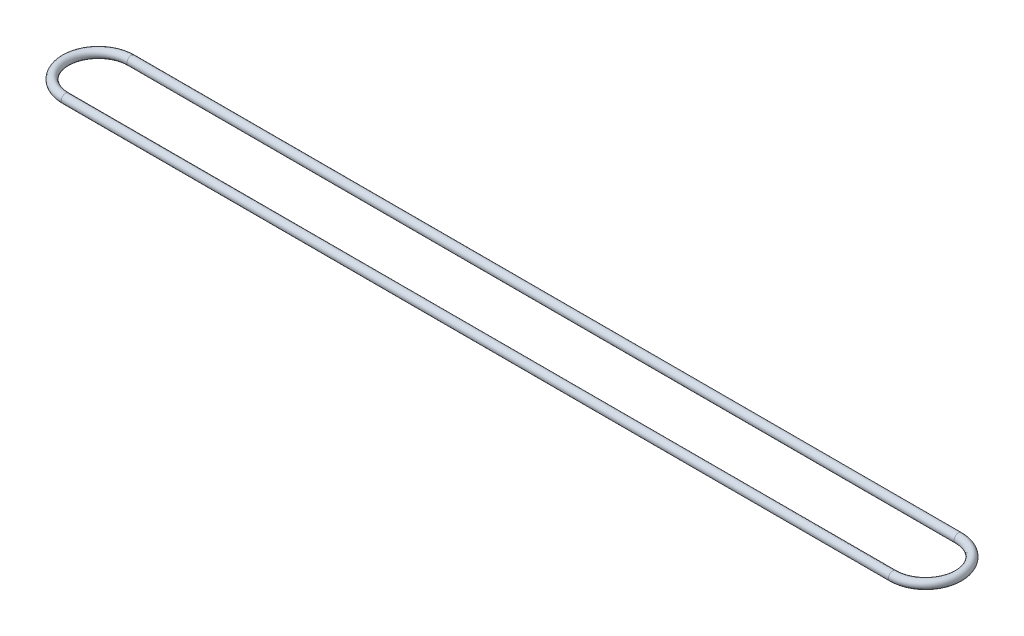
from build123d import *

# Parameters (mm, degrees)
SWEEP1_PROFILE_R = 4.7625


with BuildPart() as part:
    # Sweep1: sweep along a path in Sketch5
    with BuildLine(Plane(origin=(0, 0, 0), x_dir=(1, 0, 0), z_dir=(0, 1, 0))) as sweep1_path:
        Line((-506.592392013, 36.432296465), (411.143015057, 36.432296465))
        ThreePointArc((411.143015057, 36.432296465), (447.575311522, 0), (411.143015057, -36.432296465))
        Line((411.143015057, -36.432296465), (-506.592392013, -36.432296465))
        ThreePointArc((-506.592392013, -36.432296465), (-543.024688478, 0), (-506.592392013, 36.432296465))
    # Sweep1 profile (on start of the path) → Sweep1 (sweep)
    with BuildSketch(Plane(origin=(-506.592392013, 0, -36.432296465), x_dir=(0, 0, 1), z_dir=(1, 0, 0))):
        Circle(SWEEP1_PROFILE_R)
    sweep(path=sweep1_path.line)


solid = part.part
